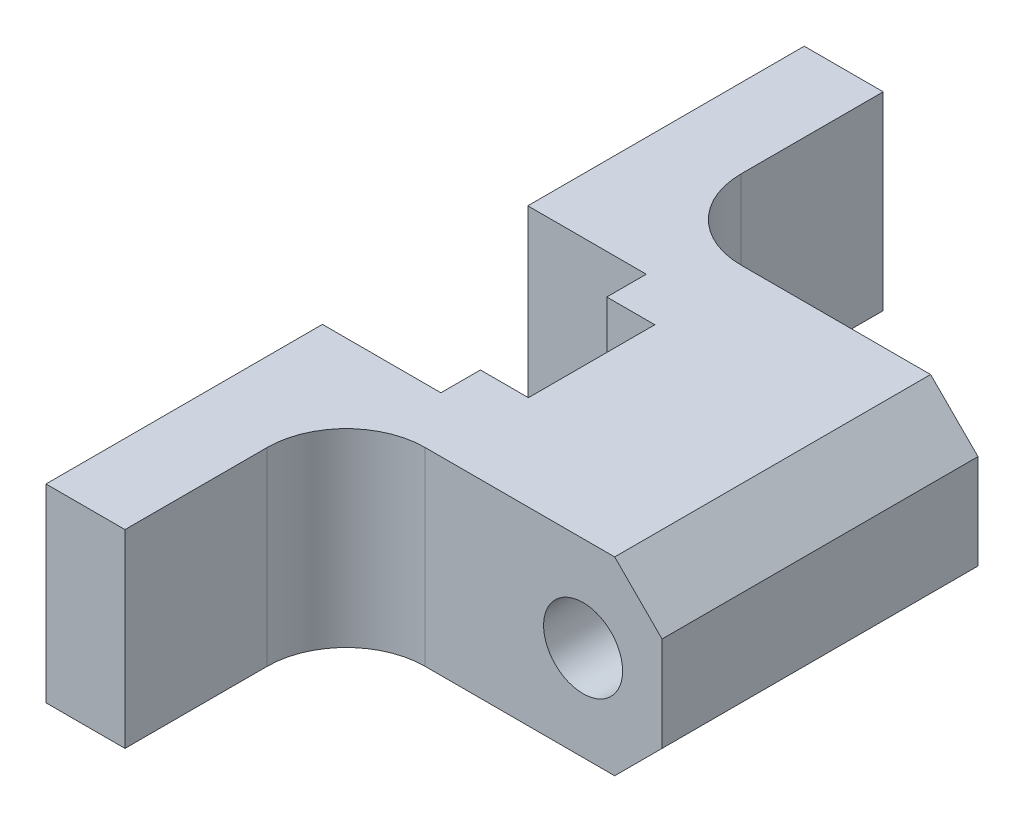
from build123d import *

# Parameters (mm, degrees)
SKETCH_1_W          = 20
SKETCH_1_H          = 12
EXTRUDE_1_DEPTH     = 25
SKETCH_5_R          = 2.5
CUT_EXTRUDE_2_DEPTH = 57.563315968
SKETCH_6_W          = 14
SKETCH_6_H          = 12
EXTRUDE_2_DEPTH     = 5
CHAMFER_1_SIZE      = 3
CUT_EXTRUDE_3_DEPTH = 44.874821937
FILLET_1_R          = 5


with BuildPart() as part:
    # Эскиз1 → Вытянуть1 (new body)
    with BuildSketch(Plane(origin=(0, 0, 0), x_dir=(0, 0, -1), z_dir=(1, 0, 0))):
        with Locations((-10, -40.630555576)):
            Rectangle(SKETCH_1_W, SKETCH_1_H)
    extrude(amount=EXTRUDE_1_DEPTH)

    # Эскиз5 → Вырез-Вытянуть2 (cut, through all)
    with BuildSketch(Plane.XY.offset(20)):
        with Locations((20, -40.630555576)):
            Circle(SKETCH_5_R)
    extrude(amount=-CUT_EXTRUDE_2_DEPTH, mode=Mode.SUBTRACT)

    # Эскиз6 → Вытянуть2 (add)
    with BuildSketch(Plane.ZY):
        with Locations((27, -40.630555576)):
            Rectangle(SKETCH_6_W, SKETCH_6_H)
        with Locations((-7, -40.630555576)):
            Rectangle(SKETCH_6_W, SKETCH_6_H)
    extrude(amount=-EXTRUDE_2_DEPTH)

    # Фаска1
    chamfer_1_edges = [part.edges().sort_by_distance(p)[0] for p in [
        (25, -46.630555576, 10),
        (25, -34.630555576, 10),
    ]]
    chamfer(chamfer_1_edges, length=CHAMFER_1_SIZE)

    # Эскиз8 → Вытянуть3 (cut, through all)
    with BuildSketch(Plane(origin=(0, -34.630555576, 0), x_dir=(1, 0, 0), z_dir=(0, 1, 0))):
        Polygon((-15.5, -3.5), (7.5, -3.5), (7.5, -6), (10.541246576, -6), (10.541246576, -14), (7.5, -14), (7.5, -16.5), (-15.5, -16.5), align=None)
    extrude(amount=-CUT_EXTRUDE_3_DEPTH, mode=Mode.SUBTRACT)

    # Скругление1
    fillet_1_edges = [part.edges().sort_by_distance(p)[0] for p in [
        (5, -40.630555576, 0),
        (5, -40.630555576, 20),
    ]]
    fillet(fillet_1_edges, radius=FILLET_1_R)


solid = part.part
